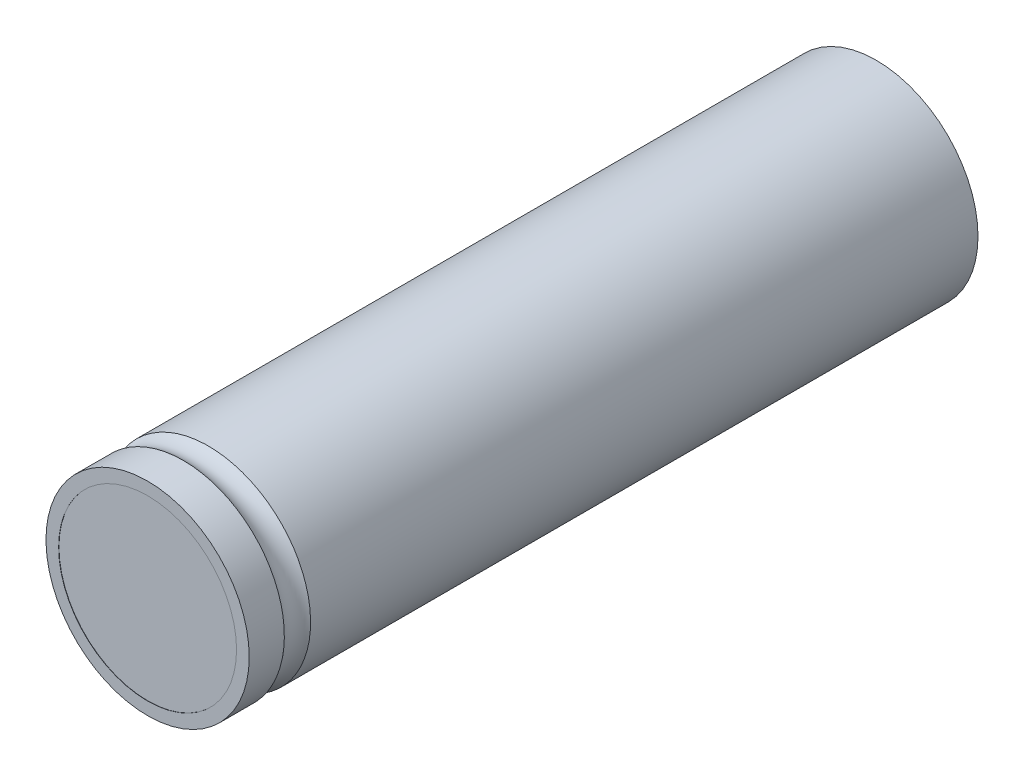
from build123d import *

# Parameters (mm, degrees)
SKETCH1_R           = 9.0678
BOSS_EXTRUDE1_DEPTH = 65.024
SKETCH4_R           = 7.937216361
CUT_EXTRUDE1_DEPTH  = 0.0254
SKETCH5_R           = 7.759625111
CUT_EXTRUDE2_DEPTH  = 0.0254
SKETCH6_R           = 4.737479436
CUT_EXTRUDE3_DEPTH  = 0.0254
CUT_EXTRUDE4_DEPTH  = 0.0254


with BuildPart() as part:
    # Sketch1 → Boss-Extrude1 (new body)
    with BuildSketch(Plane.XY):
        Circle(SKETCH1_R)
    extrude(amount=BOSS_EXTRUDE1_DEPTH)

    # Sketch2 → Cut-Revolve9 (revolve, cut)
    with BuildSketch(Plane(origin=(0, 0, 0), x_dir=(0, 0, -1), z_dir=(1, 0, 0)), mode=Mode.PRIVATE) as cut_revolve9_sk:
        with BuildLine():
            Line((-61.980472201, 9.198093657), (-59.460775409, 9.198093657))
            ThreePointArc((-59.460775409, 9.198093657), (-60.720623805, 8.672006552), (-61.980472201, 9.198093657))
        make_face()
    revolve(cut_revolve9_sk.sketch.rotate(Axis((0, 0.04619124, -3.327942322), (0, 0, 1)), 130.442191922), axis=Axis((0, 0.04619124, -3.327942322), (0, 0, 1)), mode=Mode.SUBTRACT)

    # Sketch4 → Cut-Extrude1 (cut)
    with BuildSketch(Plane.XY.offset(65.024)):
        Circle(SKETCH4_R)
    extrude(amount=-CUT_EXTRUDE1_DEPTH, mode=Mode.SUBTRACT)

    # Sketch5 → Cut-Extrude2 (cut)
    with BuildSketch(Plane(origin=(0, 0, 0), x_dir=(-1, 0, 0), z_dir=(0, 0, -1))):
        Circle(SKETCH5_R)
    extrude(amount=-CUT_EXTRUDE2_DEPTH, mode=Mode.SUBTRACT)

    # Sketch6 → Cut-Extrude3 (cut)
    with BuildSketch(Plane(origin=(0, 0, 0.0254), x_dir=(-1, 0, 0), z_dir=(0, 0, -1))):
        Circle(SKETCH6_R)
    extrude(amount=-CUT_EXTRUDE3_DEPTH, mode=Mode.SUBTRACT)

    # Sketch7 → Cut-Extrude4 (cut)
    with BuildSketch(Plane(origin=(0, 0, 0.0508), x_dir=(-1, 0, 0), z_dir=(0, 0, -1))):
        Polygon((0.885352187, 0.786979722), (2.508497864, 0.786979722), (2.508497864, -0.541048559), (0.885352187, -0.541048559), (0.885352187, -1.942856189), (-0.664014141, -1.942856189), (-0.664014141, -0.541048559), (-2.115008003, -0.541048559), (-2.115008003, 0.786979722), (-0.664014141, 0.786979722), (-0.664014141, 2.090414887), (0.885352187, 2.090414887), align=None)
    extrude(amount=-CUT_EXTRUDE4_DEPTH, mode=Mode.SUBTRACT)


solid = part.part
